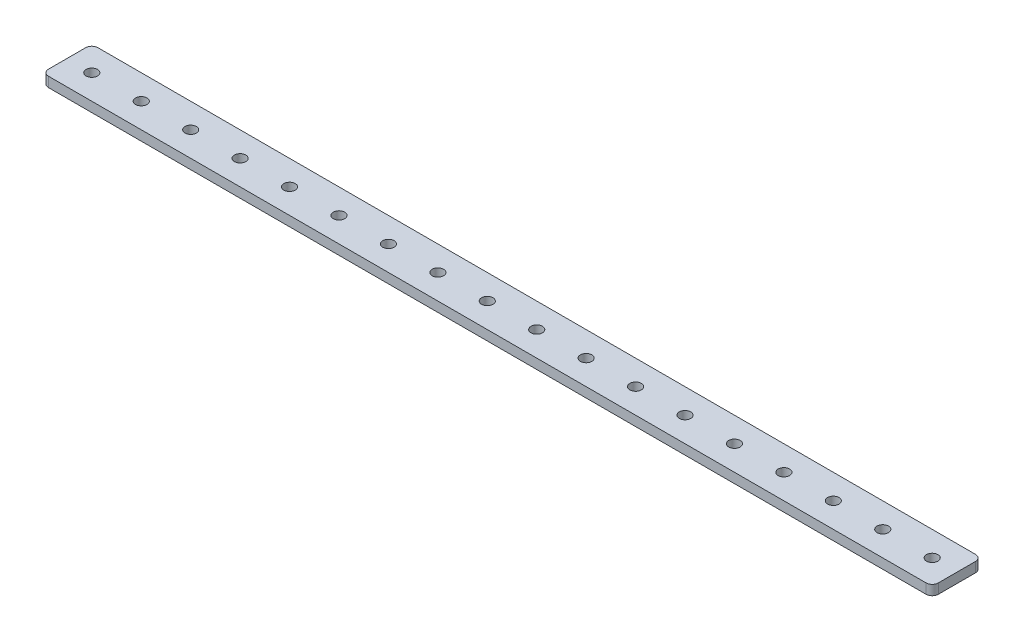
from build123d import *

# Parameters (mm, degrees)
SKETCH1_W          = 288
SKETCH1_H          = 16
EXTRUDE1_DEPTH     = 1.6
CUT_EXTRUDE1_REACH = 146.258
SKETCH2_R          = 1.85
LPATTERN1_COUNT    = 18
LPATTERN1_PITCH    = 16
FILLET1_R          = 2


with BuildPart() as part:
    # Sketch1 → Extrude1 (new, symmetric)
    with BuildSketch(Plane(origin=(0, 0, 0), x_dir=(1, 0, 0), z_dir=(0, 1, 0))):
        Rectangle(SKETCH1_W, SKETCH1_H)
    extrude(amount=EXTRUDE1_DEPTH, both=True)

    # Sketch2 → Cut-Extrude1 (cut, up to next)
    with BuildSketch(Plane(origin=(0, 1.6, 0), x_dir=(1, 0, 0), z_dir=(0, 1, 0)), mode=Mode.PRIVATE) as cut_extrude1_sk1:
        with Locations(Location((-136, 0, 0), (0, 0, 270))):
            Circle(SKETCH2_R)
    cut_extrude1_tool1 = extrude(cut_extrude1_sk1.sketch, amount=-CUT_EXTRUDE1_REACH, mode=Mode.PRIVATE) & part.part
    cut_extrude1 = cut_extrude1_tool1.solids().sort_by_distance((-136, 1.6, 0))[0]
    add(cut_extrude1, mode=Mode.SUBTRACT)

    # LPattern1: Cut-Extrude1 ×18
    with Locations(*[(i * LPATTERN1_PITCH, 0, 0) for i in range(1, LPATTERN1_COUNT)]):
        add(cut_extrude1, mode=Mode.SUBTRACT)

    # Fillet1
    fillet1_edges = [part.edges().sort_by_distance(p)[0] for p in [
        (-144, 0, -8),
        (144, 0, -8),
        (144, 0, 8),
        (-144, 0, 8),
    ]]
    fillet(fillet1_edges, radius=FILLET1_R)


solid = part.part
